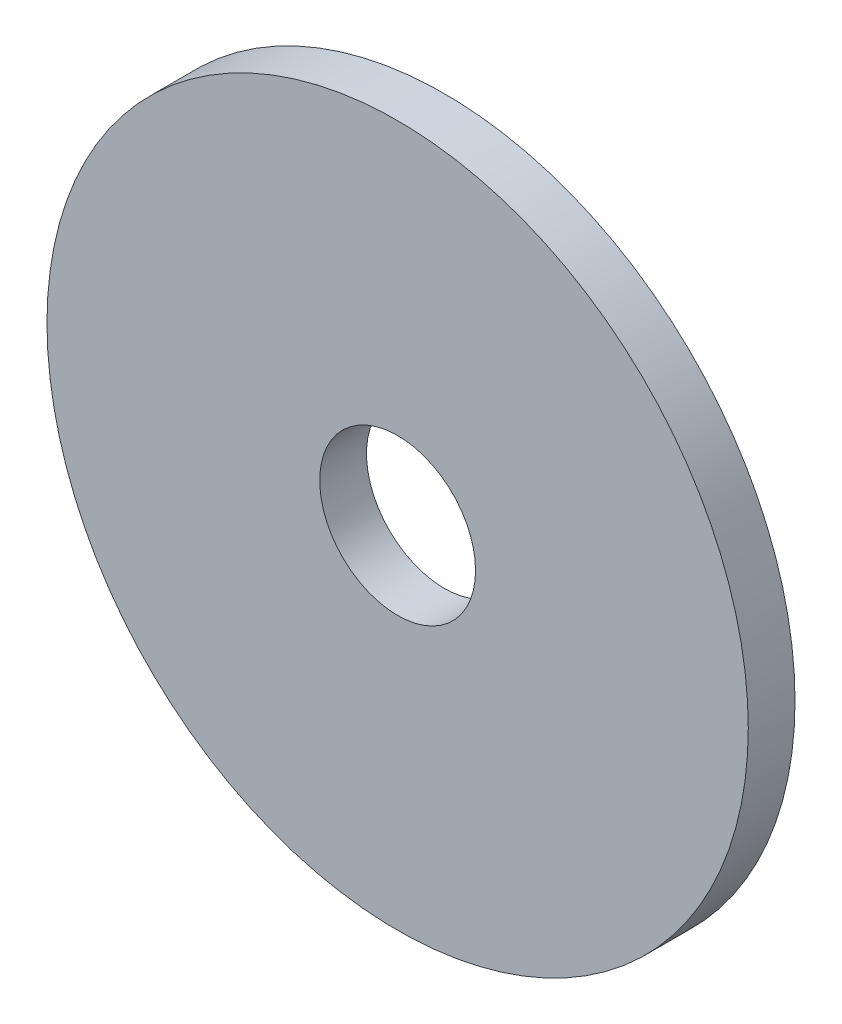
from build123d import *

# Parameters (mm, degrees)
SKETCH1_R           = 22.5
SKETCH1_R_2         = 5
BOSS_EXTRUDE1_DEPTH = 3


with BuildPart() as part:
    # Sketch1 → Boss-Extrude1 (new body)
    with BuildSketch(Plane.XY):
        Circle(SKETCH1_R)
        Circle(SKETCH1_R_2, mode=Mode.SUBTRACT)
    extrude(amount=BOSS_EXTRUDE1_DEPTH)


solid = part.part
